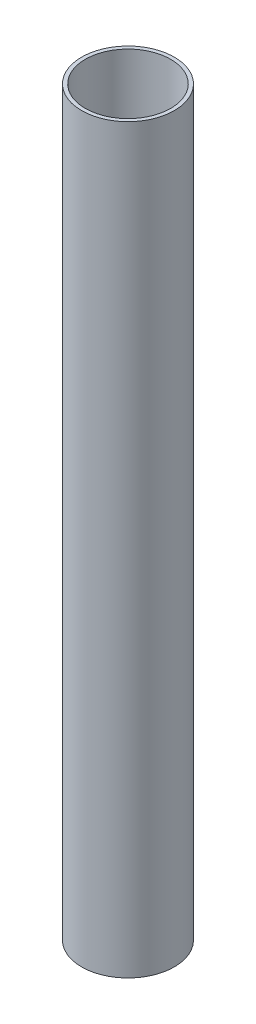
from build123d import *

# Parameters (mm, degrees)
SKETCH1_R           = 12.5
SKETCH1_R_2         = 11.5
BOSS_EXTRUDE1_DEPTH = 200


with BuildPart() as part:
    # Sketch1 → Boss-Extrude1 (new body)
    with BuildSketch(Plane(origin=(0, 0, 0), x_dir=(1, 0, 0), z_dir=(0, 1, 0))):
        with Locations(Location((0, 0, 0), (0, 0, 270))):
            Circle(SKETCH1_R)
        with Locations(Location((0, 0, 0), (0, 0, 270))):
            Circle(SKETCH1_R_2, mode=Mode.SUBTRACT)
    extrude(amount=BOSS_EXTRUDE1_DEPTH)


solid = part.part
